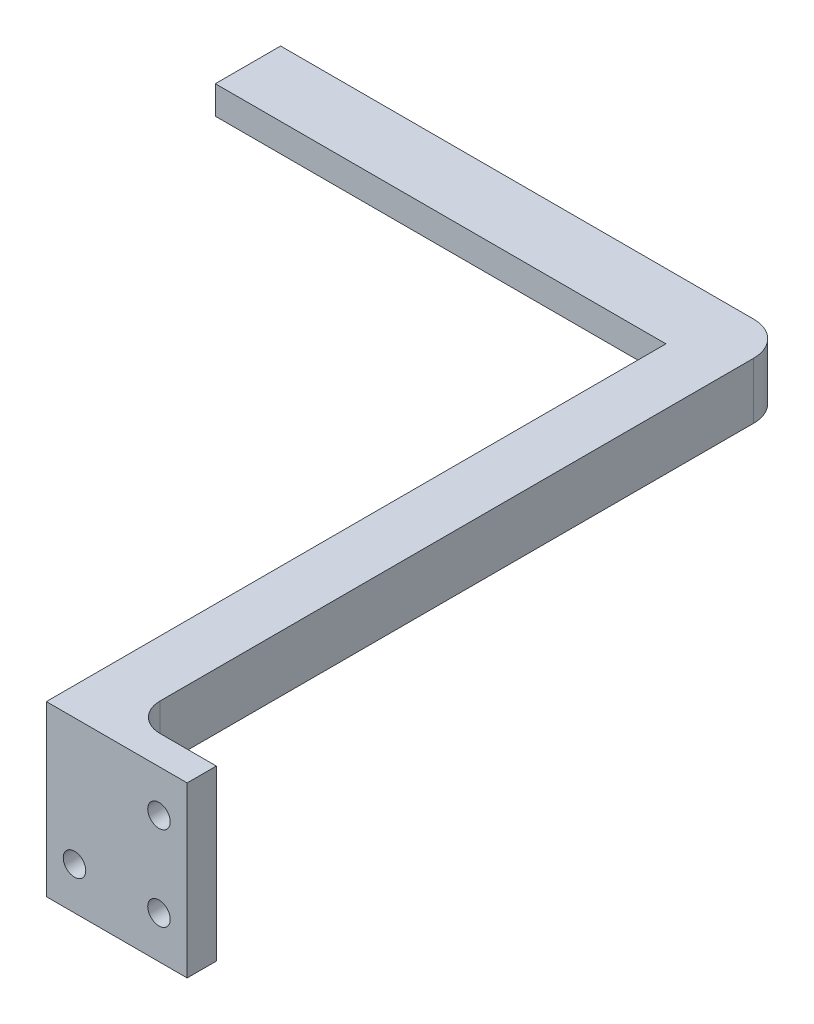
from build123d import *

# Parameters (mm, degrees)
SKETCH1_W           = 10
SKETCH1_H           = 110
SKETCH1_W_2         = 15
SKETCH1_H_2         = 7.182689318
BOSS_EXTRUDE1_DEPTH = 10
SKETCH2_W           = 25
SKETCH2_H           = 7.182689318
BOSS_EXTRUDE2_DEPTH = 20
SKETCH3_R           = 2
CUT_EXTRUDE1_DEPTH  = 20
SKETCH4_R           = 2
CUT_EXTRUDE2_DEPTH  = 2
FILLET2_R           = 5
CHAMFER2_SIZE       = 5
FILLET3_R           = 6


with BuildPart() as part:
    # Sketch1 → Boss-Extrude1 (new body)
    with BuildSketch(Plane(origin=(0, 0, 0), x_dir=(1, 0, 0), z_dir=(0, 1, 0))):
        Polygon((-10, 110), (0, 110), (0, 121.590602055), (-90, 121.590602055), (-90, 110), align=None)
        with Locations((-5, 55)):
            Rectangle(SKETCH1_W, SKETCH1_H)
        with Locations((7.5, 3.591344659)):
            Rectangle(SKETCH1_W_2, SKETCH1_H_2)
    extrude(amount=BOSS_EXTRUDE1_DEPTH)

    # Sketch2 → Boss-Extrude2 (add)
    with BuildSketch(Plane.XZ):
        with Locations((2.5, -3.591344659)):
            Rectangle(SKETCH2_W, SKETCH2_H)
    extrude(amount=BOSS_EXTRUDE2_DEPTH)

    # Sketch3 → Cut-Extrude1 (cut)
    with BuildSketch(Plane(origin=(0, 0, -7.182689318), x_dir=(-1, 0, 0), z_dir=(0, 0, -1))):
        with Locations((-10, 2.5)):
            Circle(SKETCH3_R)
        with Locations(Location((-10, -12.5, 0), (0, 0, 180))):
            Circle(SKETCH3_R)
        with Locations((5, -12.5)):
            Circle(SKETCH3_R)
    extrude(amount=-CUT_EXTRUDE1_DEPTH, mode=Mode.SUBTRACT)

    # Sketch4 → Cut-Extrude2 (cut)
    with BuildSketch(Plane(origin=(0, 0, -7.182689318), x_dir=(-1, 0, 0), z_dir=(0, 0, -1))):
        Polygon((10, 0), (0, 0), (0, 10), (-15, 10), (-15, -20), (10, -20), align=None)
        with Locations((5, -12.5)):
            Circle(SKETCH4_R, mode=Mode.SUBTRACT)
        with Locations((-10, -12.5)):
            Circle(SKETCH4_R, mode=Mode.SUBTRACT)
        with Locations((-10, 2.5)):
            Circle(SKETCH4_R, mode=Mode.SUBTRACT)
    extrude(amount=-CUT_EXTRUDE2_DEPTH, mode=Mode.SUBTRACT)

    # Fillet2
    fillet2_edges = [part.edges().sort_by_distance(p)[0] for p in [
        (0, 5, -5.182689318),
        (-5, 0, -5.182689318),
    ]]
    fillet(fillet2_edges, radius=FILLET2_R)

    # Chamfer2
    chamfer2_edges = [part.edges().sort_by_distance(p)[0] for p in [
        (-50, 0, -110),
    ]]
    chamfer(chamfer2_edges, length=CHAMFER2_SIZE)

    # Fillet3
    fillet3_edges = [part.edges().sort_by_distance(p)[0] for p in [
        (0, 5, -121.590602055),
    ]]
    fillet(fillet3_edges, radius=FILLET3_R)


solid = part.part
